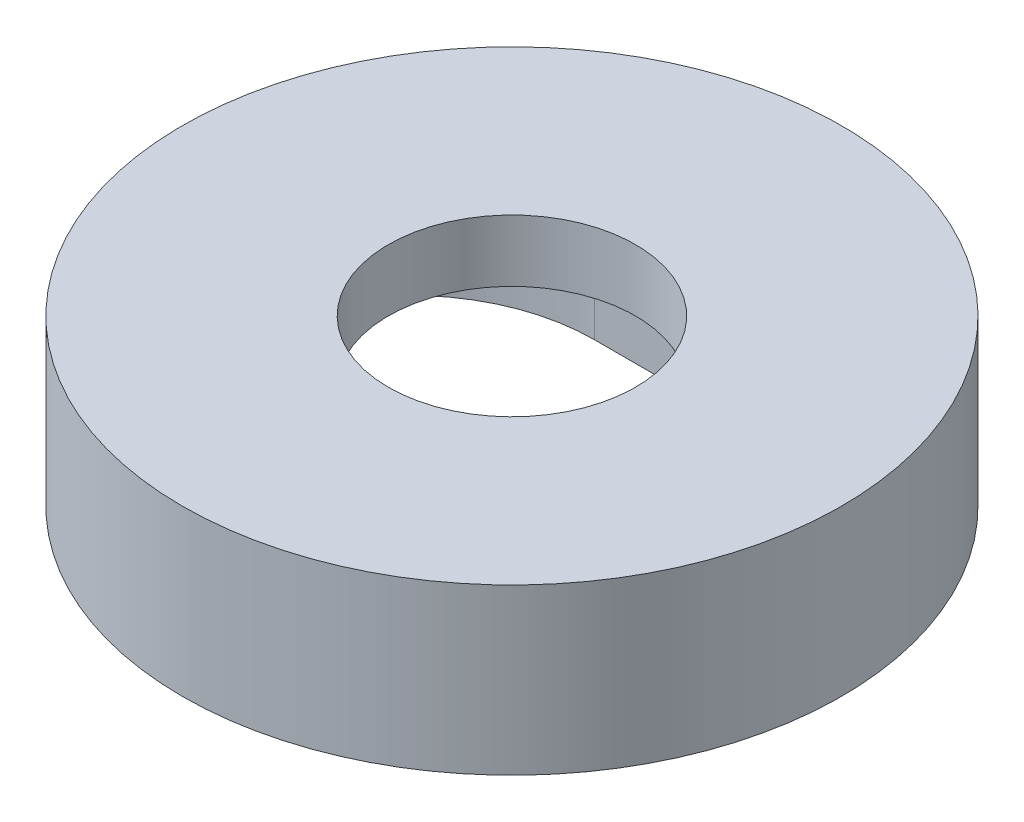
from build123d import *

# Parameters (mm, degrees)
ESQUISSE2_R             = 16
BOSS_EXTRU_1_DEPTH      = 8
ENL_V_MAT_EXTRU_1_DEPTH = 5
ESQUISSE3_R             = 6
ENL_V_MAT_EXTRU_2_DEPTH = 25


with BuildPart() as part:
    # Esquisse2 → Boss.-Extru.1 (new body)
    with BuildSketch(Plane(origin=(0, 0, 0), x_dir=(1, 0, 0), z_dir=(0, 1, 0))):
        with Locations(Location((0, 0, 0), (0, 0, 270))):
            Circle(ESQUISSE2_R)
    extrude(amount=BOSS_EXTRU_1_DEPTH)

    # Esquisse1 → Enlèv. mat.-Extru.1 (cut)
    with BuildSketch(Plane(origin=(0, 0, 0), x_dir=(1, 0, 0), z_dir=(0, 1, 0))):
        with BuildLine():
            Line((-5, 9), (5, 9))
            ThreePointArc((5, 9), (14, 0), (5, -9))
            Line((5, -9), (-5, -9))
            ThreePointArc((-5, -9), (-14, 0), (-5, 9))
        make_face()
    extrude(amount=ENL_V_MAT_EXTRU_1_DEPTH, mode=Mode.SUBTRACT)

    # Esquisse3 → Enlèv. mat.-Extru.2 (cut, through all)
    with BuildSketch(Plane(origin=(0, 8, 0), x_dir=(1, 0, 0), z_dir=(0, 1, 0))):
        with Locations(Location((0, 0, 0), (0, 0, 270))):
            Circle(ESQUISSE3_R)
    extrude(amount=-ENL_V_MAT_EXTRU_2_DEPTH, mode=Mode.SUBTRACT)


solid = part.part
